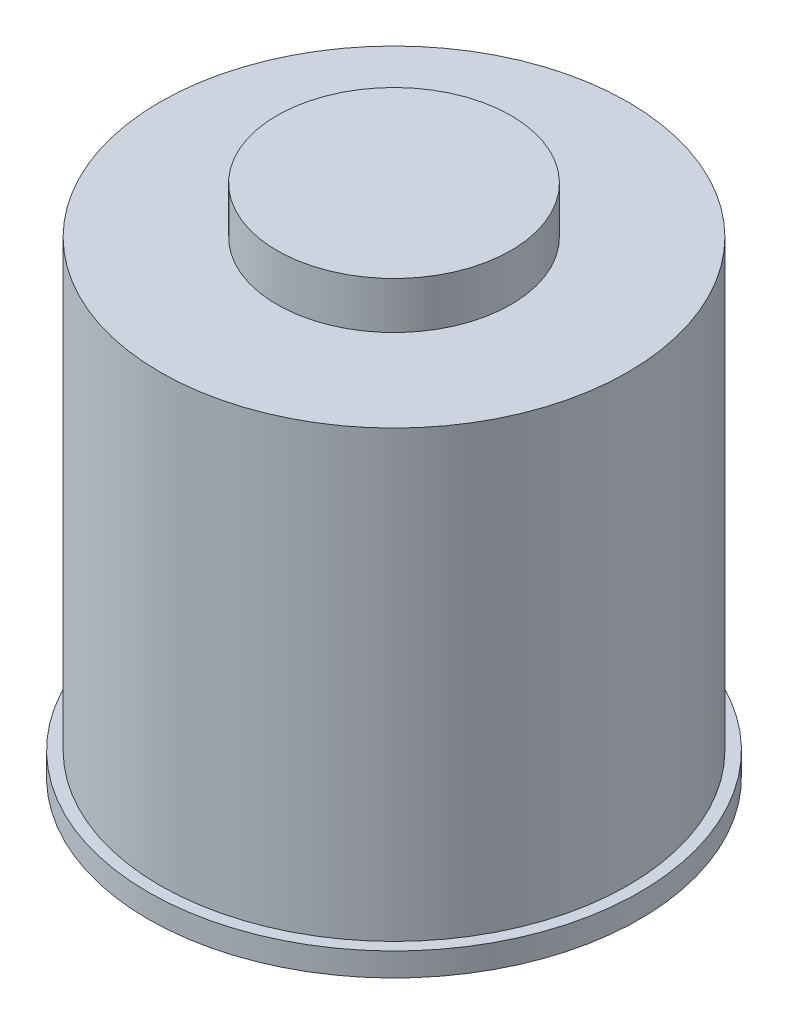
from build123d import *


with BuildPart() as part:
    # Esquisse1 → Révolution1 (revolve)
    with BuildSketch(Plane(origin=(0, 0, 0), x_dir=(0, 0, -1), z_dir=(1, 0, 0))):
        with BuildLine():
            Line((10.5, 0), (3, 0))
            ThreePointArc((3, 0), (2.121320344, -2.121320344), (0, -3))
            Line((0, -3), (0, 0))
            Line((0, 0), (0, 20))
            Line((0, 20), (0, 22))
            Line((0, 22), (5, 22))
            Line((5, 22), (5, 20))
            Line((5, 20), (10, 20))
            Line((10, 20), (10, 1))
            Line((10, 1), (10.5, 1))
            Line((10.5, 1), (10.5, 0))
        make_face()
    revolve(axis=Axis((0, 0, 0), (0, 1, 0)))


solid = part.part
